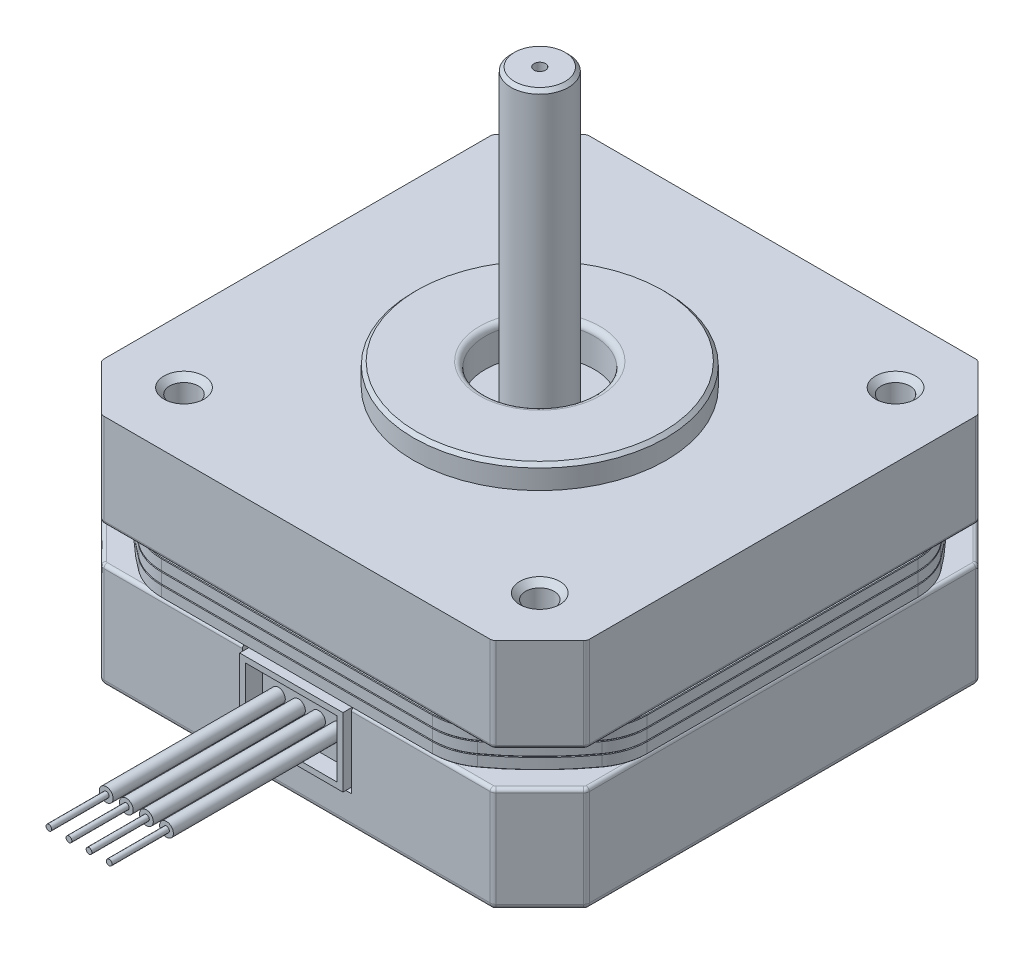
from build123d import *

# Parameters (mm, degrees)
EXTRUDE_1_DEPTH        = 9.2
EXTRUDE_START          = 20.4
EXTRUDE_2_DEPTH        = 8.2
EXTRUDE_3_DEPTH        = 1
PATTERN_LINEAR_1_COUNT = 3
PATTERN_LINEAR_1_PITCH = 1
SKETCH_3_R             = 4.75
CUT_EXTRUDE_1_DEPTH    = 3
SKETCH_4_R             = 4.75
SKETCH_4_R_2           = 2.5
CUT_EXTRUDE_2_DEPTH    = 0.5
SKETCH_5_R             = 0.5
CUT_EXTRUDE_3_DEPTH    = 0.5
CHAMFER_1_SIZE         = 0.3
FILLET_1_R             = 0.5
FILLET_2_R             = 0.5
SKETCH_6_R             = 11
SKETCH_6_R_2           = 4.75
EXTRUDE_4_DEPTH        = 2
CUT_EXTRUDE_START      = -1
SKETCH_7_R             = 4.75
CUT_EXTRUDE_4_DEPTH    = 1
CHAMFER_2_SIZE         = 0.3
FILLET_3_R             = 0.5
SKETCH_8_R             = 2.5
EXTRUDE_5_DEPTH        = 25.2
CHAMFER_4_SIZE         = 0.3
SKETCH_9_R             = 0.5
CUT_EXTRUDE_5_DEPTH    = 1
SKETCH_10_W            = 9.5
SKETCH_10_H            = 6.5
CUT_EXTRUDE_6_DEPTH    = 1
SKETCH_11_W            = 9
SKETCH_11_H            = 6
SKETCH_11_W_2          = 8
SKETCH_11_H_2          = 5
EXTRUDE_6_DEPTH        = 1.5
SKETCH_12_R            = 0.6
SKETCH_12_R_2          = 0.25
EXTRUDE_7_DEPTH        = 15
EXTRUDE_7_2_DEPTH      = 15
EXTRUDE_7_3_DEPTH      = 15
EXTRUDE_7_4_DEPTH      = 15
SKETCH_12_2_R          = 0.25
EXTRUDE_8_DEPTH        = 20
EXTRUDE_8_2_DEPTH      = 20
EXTRUDE_8_3_DEPTH      = 20
EXTRUDE_8_4_DEPTH      = 20
CHAMFER_32_SIZE        = 0.05
CHAMFER_33_SIZE        = 0.05
CHAMFER_34_SIZE        = 0.05
SKETCH_16_R            = 1.25
CUT_EXTRUDE_9_DEPTH    = 7
CHAMFER_35_SIZE        = 0.5
FILLET_4_R             = 0.3
FILLET_5_R             = 0.3


with BuildPart() as part:
    # Эскиз1 → Бобышка-Вытянуть1 (new body)
    with BuildSketch(Plane(origin=(0, 0, 0), x_dir=(1, 0, 0), z_dir=(0, 1, 0))):
        Polygon((-17.033766184, 21.15), (-21.15, 17.033766184), (-21.15, -17.033766184), (-17.033766184, -21.15), (17.033766184, -21.15), (21.15, -17.033766184), (21.15, 17.033766184), (17.033766184, 21.15), align=None)
    extrude(amount=EXTRUDE_1_DEPTH)

    # Эскиз3 → Вырез-Вытянуть1 (cut)
    with BuildSketch(Plane.XZ):
        with Locations(Location((0, 0, 0), (0, 0, 270))):
            Circle(SKETCH_3_R)
    extrude(amount=-CUT_EXTRUDE_1_DEPTH, mode=Mode.SUBTRACT)

    # Эскиз4 → Вырез-Вытянуть2 (cut)
    with BuildSketch(Plane.XZ.offset(-3)):
        with Locations(Location((0, 0, 0), (0, 0, 270))):
            Circle(SKETCH_4_R)
        with Locations(Location((0, 0, 0), (0, 0, 270))):
            Circle(SKETCH_4_R_2, mode=Mode.SUBTRACT)
    extrude(amount=-CUT_EXTRUDE_2_DEPTH, mode=Mode.SUBTRACT)

    # Эскиз5 → Вырез-Вытянуть3 (cut)
    with BuildSketch(Plane.XZ.offset(-3)):
        with Locations(Location((0, 0, 0), (0, 0, 270))):
            Circle(SKETCH_5_R)
    extrude(amount=-CUT_EXTRUDE_3_DEPTH, mode=Mode.SUBTRACT)

    # Фаска1
    chamfer_1_edges = [part.edges().sort_by_distance(p)[0] for p in [
        (0, 3, 2.5),
    ]]
    chamfer(chamfer_1_edges, length=CHAMFER_1_SIZE)

    # Скругление1
    fillet_1_edges = [part.edges().sort_by_distance(p)[0] for p in [
        (-21.15, 0, 0),
        (-19.091883092, 0, -19.091883092),
        (0, 0, -21.15),
        (19.091883092, 0, -19.091883092),
        (21.15, 0, 0),
        (19.091883092, 0, 19.091883092),
        (0, 0, 21.15),
        (-19.091883092, 0, 19.091883092),
        (-21.15, 4.6, 17.033766184),
        (-21.15, 4.6, -17.033766184),
        (-17.033766184, 4.6, -21.15),
        (17.033766184, 4.6, -21.15),
        (21.15, 4.6, -17.033766184),
        (21.15, 4.6, 17.033766184),
        (17.033766184, 4.6, 21.15),
        (-17.033766184, 4.6, 21.15),
        (0, 0, 4.75),
    ]]
    fillet(fillet_1_edges, radius=FILLET_1_R)

    # Эскиз10 → Вырез-Вытянуть6 (cut)
    with BuildSketch(Plane.XY.offset(21.15)):
        with Locations((0, 5.95)):
            Rectangle(SKETCH_10_W, SKETCH_10_H)
    extrude(amount=-CUT_EXTRUDE_6_DEPTH, mode=Mode.SUBTRACT)

    # Скругление4
    fillet_4_edges = [part.edges().sort_by_distance(p)[0] for p in [
        (10.788329701, 9.2, 21.15),
        (-10.788329701, 9.2, 21.15),
        (19.091883092, 9.2, 19.091883092),
        (21.15, 9.2, 0),
        (19.091883092, 9.2, -19.091883092),
        (0, 9.2, -21.15),
        (-19.091883092, 9.2, -19.091883092),
        (-21.15, 9.2, 0),
        (-19.091883092, 9.2, 19.091883092),
        (21.111939766, 9.2, -17.018001119),
        (17.018001119, 9.2, -21.111939766),
        (-17.018001119, 9.2, -21.111939766),
        (-21.111939766, 9.2, -17.018001119),
        (-21.111939766, 9.2, 17.018001119),
        (-17.018001119, 9.2, 21.111939766),
        (17.018001119, 9.2, 21.111939766),
        (21.111939766, 9.2, 17.018001119),
    ]]
    fillet(fillet_4_edges, radius=FILLET_4_R)


with BuildPart() as body_2:
    # Эскиз1<3> → Бобышка-Вытянуть2 (new body)
    with BuildSketch(Plane(origin=(0, 0, 0), x_dir=(1, 0, 0), z_dir=(0, 1, 0)).offset(EXTRUDE_START)):
        Polygon((-17.033766184, 21.15), (-21.15, 17.033766184), (-21.15, -17.033766184), (-17.033766184, -21.15), (17.033766184, -21.15), (21.15, -17.033766184), (21.15, 17.033766184), (17.033766184, 21.15), align=None)
    extrude(amount=-EXTRUDE_2_DEPTH)

    # Скругление2
    fillet_2_edges = [body_2.edges().sort_by_distance(p)[0] for p in [
        (-21.15, 16.3, 17.033766184),
        (-21.15, 16.3, -17.033766184),
        (-17.033766184, 16.3, -21.15),
        (17.033766184, 16.3, -21.15),
        (21.15, 16.3, -17.033766184),
        (21.15, 16.3, 17.033766184),
        (17.033766184, 16.3, 21.15),
        (-17.033766184, 16.3, 21.15),
    ]]
    fillet(fillet_2_edges, radius=FILLET_2_R)

    # Эскиз6 → Бобышка-Вытянуть4 (add)
    with BuildSketch(Plane(origin=(0, 20.4, 0), x_dir=(1, 0, 0), z_dir=(0, 1, 0))):
        with Locations(Location((0, 0, 0), (0, 0, 270))):
            Circle(SKETCH_6_R)
        with Locations(Location((0, 0, 0), (0, 0, 270))):
            Circle(SKETCH_6_R_2, mode=Mode.SUBTRACT)
    extrude(amount=EXTRUDE_4_DEPTH)

    # Эскиз7 → Вырез-Вытянуть4 (cut)
    with BuildSketch(Plane(origin=(0, 20.4, 0), x_dir=(1, 0, 0), z_dir=(0, 1, 0)).offset(CUT_EXTRUDE_START)):
        with Locations(Location((0, 0, 0), (0, 0, 270))):
            Circle(SKETCH_7_R)
    extrude(amount=CUT_EXTRUDE_4_DEPTH, mode=Mode.SUBTRACT)

    # Фаска2
    chamfer_2_edges = [body_2.edges().sort_by_distance(p)[0] for p in [
        (0, 22.4, -11),
    ]]
    chamfer(chamfer_2_edges, length=CHAMFER_2_SIZE)

    # Скругление3
    fillet_3_edges = [body_2.edges().sort_by_distance(p)[0] for p in [
        (0, 22.4, -4.75),
    ]]
    fillet(fillet_3_edges, radius=FILLET_3_R)

    # Эскиз8 → Бобышка-Вытянуть5 (add)
    with BuildSketch(Plane(origin=(0, 19.4, 0), x_dir=(1, 0, 0), z_dir=(0, 1, 0))):
        with Locations(Location((0, 0, 0), (0, 0, 270))):
            Circle(SKETCH_8_R)
    extrude(amount=EXTRUDE_5_DEPTH)

    # Фаска4
    chamfer_4_edges = [body_2.edges().sort_by_distance(p)[0] for p in [
        (0, 44.6, -2.5),
    ]]
    chamfer(chamfer_4_edges, length=CHAMFER_4_SIZE)

    # Эскиз9 → Вырез-Вытянуть5 (cut)
    with BuildSketch(Plane(origin=(0, 44.6, 0), x_dir=(1, 0, 0), z_dir=(0, 1, 0)).offset(CUT_EXTRUDE_START)):
        with Locations(Location((0, 0, 0), (0, 0, 270))):
            Circle(SKETCH_9_R)
    extrude(amount=CUT_EXTRUDE_5_DEPTH, mode=Mode.SUBTRACT)

    # Эскиз16 → Вырез-Вытянуть9 (cut)
    with BuildSketch(Plane(origin=(0, 20.4, 0), x_dir=(1, 0, 0), z_dir=(0, 1, 0))):
        with Locations(Location((-15.5, 15.5, 0), (0, 0, 270))):
            Circle(SKETCH_16_R)
        with Locations(Location((15.5, 15.5, 0), (0, 0, 270))):
            Circle(SKETCH_16_R)
        with Locations(Location((15.5, -15.5, 0), (0, 0, 270))):
            Circle(SKETCH_16_R)
        with Locations(Location((-15.5, -15.5, 0), (0, 0, 270))):
            Circle(SKETCH_16_R)
    extrude(amount=-CUT_EXTRUDE_9_DEPTH, mode=Mode.SUBTRACT)

    # Фаска35
    chamfer_35_edges = [body_2.edges().sort_by_distance(p)[0] for p in [
        (-15.5, 20.4, -16.75),
        (15.5, 20.4, -16.75),
        (15.5, 20.4, 14.25),
        (-15.5, 20.4, 14.25),
    ]]
    chamfer(chamfer_35_edges, length=CHAMFER_35_SIZE)

    # Скругление5
    fillet_5_edges = [body_2.edges().sort_by_distance(p)[0] for p in [
        (19.091883092, 12.2, 19.091883092),
        (21.15, 12.2, 0),
        (-19.091883092, 12.2, 19.091883092),
        (-21.15, 12.2, 0),
        (-19.091883092, 12.2, -19.091883092),
        (0, 12.2, -21.15),
        (19.091883092, 12.2, -19.091883092),
        (0, 12.2, 21.15),
        (21.111939766, 12.2, -17.018001119),
        (17.018001119, 12.2, -21.111939766),
        (-17.018001119, 12.2, -21.111939766),
        (-21.111939766, 12.2, -17.018001119),
        (-21.111939766, 12.2, 17.018001119),
        (-17.018001119, 12.2, 21.111939766),
        (17.018001119, 12.2, 21.111939766),
        (21.111939766, 12.2, 17.018001119),
    ]]
    fillet(fillet_5_edges, radius=FILLET_5_R)


with BuildPart() as body_3:
    # Эскиз2 → Бобышка-Вытянуть3 (new body)
    with BuildSketch(Plane(origin=(0, 9.2, 0), x_dir=(1, 0, 0), z_dir=(0, 1, 0))):
        with BuildLine():
            Line((-11.797351398, -21.15), (11.797351398, -21.15))
            ThreePointArc((11.797351398, -21.15), (13.348560603, -20.903288335), (14.746689247, -20.1875))
            ThreePointArc((14.746689247, -20.1875), (17.67766953, -17.67766953), (20.1875, -14.746689247))
            ThreePointArc((20.1875, -14.746689247), (20.903288335, -13.348560603), (21.15, -11.797351398))
            Line((21.15, -11.797351398), (21.15, 11.797351398))
            ThreePointArc((21.15, 11.797351398), (20.903288335, 13.348560603), (20.1875, 14.746689247))
            ThreePointArc((20.1875, 14.746689247), (17.67766953, 17.67766953), (14.746689247, 20.1875))
            ThreePointArc((14.746689247, 20.1875), (13.348560603, 20.903288335), (11.797351398, 21.15))
            Line((11.797351398, 21.15), (-11.797351398, 21.15))
            ThreePointArc((-11.797351398, 21.15), (-13.348560603, 20.903288335), (-14.746689247, 20.1875))
            ThreePointArc((-14.746689247, 20.1875), (-17.67766953, 17.67766953), (-20.1875, 14.746689247))
            ThreePointArc((-20.1875, 14.746689247), (-20.903288335, 13.348560603), (-21.15, 11.797351398))
            Line((-21.15, 11.797351398), (-21.15, -11.797351398))
            ThreePointArc((-21.15, -11.797351398), (-20.903288335, -13.348560603), (-20.1875, -14.746689247))
            ThreePointArc((-20.1875, -14.746689247), (-17.67766953, -17.67766953), (-14.746689247, -20.1875))
            ThreePointArc((-14.746689247, -20.1875), (-13.348560603, -20.903288335), (-11.797351398, -21.15))
        make_face()
    extrude(amount=EXTRUDE_3_DEPTH)


with BuildPart() as pattern_linear_1_1:
    # Линейный массив1: pattern copy
    add(body_3.part.moved(Location(Vector(0, 1, 0) * (1 * PATTERN_LINEAR_1_PITCH))))

    # Фаска33
    chamfer_33_edges = [pattern_linear_1_1.edges().sort_by_distance(p)[0] for p in [
        (-13.348560603, 11.2, -20.903288335),
        (-17.67766953, 11.2, -17.67766953),
        (17.67766953, 10.2, -17.67766953),
        (20.903288335, 10.2, -13.348560603),
        (21.15, 10.2, 0),
        (20.903288335, 10.2, 13.348560603),
        (17.67766953, 10.2, 17.67766953),
        (-20.903288335, 11.2, -13.348560603),
        (13.348560603, 10.2, 20.903288335),
        (0, 10.2, 21.15),
        (-13.348560603, 10.2, 20.903288335),
        (-17.67766953, 10.2, 17.67766953),
        (-20.903288335, 10.2, 13.348560603),
        (-21.15, 10.2, 0),
        (-20.903288335, 10.2, -13.348560603),
        (-17.67766953, 10.2, -17.67766953),
        (-21.15, 11.2, 0),
        (-13.348560603, 10.2, -20.903288335),
        (0, 10.2, -21.15),
        (13.348560603, 10.2, -20.903288335),
        (-20.903288335, 11.2, 13.348560603),
        (-17.67766953, 11.2, 17.67766953),
        (-13.348560603, 11.2, 20.903288335),
        (0, 11.2, 21.15),
        (13.348560603, 11.2, 20.903288335),
        (17.67766953, 11.2, 17.67766953),
        (13.348560603, 11.2, -20.903288335),
        (20.903288335, 11.2, 13.348560603),
        (21.15, 11.2, 0),
        (20.903288335, 11.2, -13.348560603),
        (17.67766953, 11.2, -17.67766953),
        (0, 11.2, -21.15),
    ]]
    chamfer(chamfer_33_edges, length=CHAMFER_33_SIZE)


with BuildPart() as pattern_linear_1_2:
    # Линейный массив1: pattern copy
    add(body_3.part.moved(Location(Vector(0, 1, 0) * (2 * PATTERN_LINEAR_1_PITCH))))

    # Фаска32
    chamfer_32_edges = [pattern_linear_1_2.edges().sort_by_distance(p)[0] for p in [
        (-13.348560603, 12.2, -20.903288335),
        (-17.67766953, 12.2, -17.67766953),
        (17.67766953, 11.2, -17.67766953),
        (20.903288335, 11.2, -13.348560603),
        (21.15, 11.2, 0),
        (20.903288335, 11.2, 13.348560603),
        (17.67766953, 11.2, 17.67766953),
        (-20.903288335, 12.2, -13.348560603),
        (13.348560603, 11.2, 20.903288335),
        (0, 11.2, 21.15),
        (-13.348560603, 11.2, 20.903288335),
        (-17.67766953, 11.2, 17.67766953),
        (-20.903288335, 11.2, 13.348560603),
        (-21.15, 11.2, 0),
        (-20.903288335, 11.2, -13.348560603),
        (-17.67766953, 11.2, -17.67766953),
        (-21.15, 12.2, 0),
        (-13.348560603, 11.2, -20.903288335),
        (0, 11.2, -21.15),
        (13.348560603, 11.2, -20.903288335),
        (-20.903288335, 12.2, 13.348560603),
        (-17.67766953, 12.2, 17.67766953),
        (-13.348560603, 12.2, 20.903288335),
        (0, 12.2, 21.15),
        (13.348560603, 12.2, 20.903288335),
        (17.67766953, 12.2, 17.67766953),
        (13.348560603, 12.2, -20.903288335),
        (20.903288335, 12.2, 13.348560603),
        (21.15, 12.2, 0),
        (20.903288335, 12.2, -13.348560603),
        (17.67766953, 12.2, -17.67766953),
        (0, 12.2, -21.15),
    ]]
    chamfer(chamfer_32_edges, length=CHAMFER_32_SIZE)


with BuildPart() as body_6:
    # Эскиз11 → Бобышка-Вытянуть6 (new body)
    with BuildSketch(Plane.XY.offset(20.15)):
        with Locations((0, 5.95)):
            Rectangle(SKETCH_11_W, SKETCH_11_H)
        with Locations((0, 5.95)):
            Rectangle(SKETCH_11_W_2, SKETCH_11_H_2, mode=Mode.SUBTRACT)
    extrude(amount=EXTRUDE_6_DEPTH)


with BuildPart() as body_7:
    # Эскиз12 → Бобышка-Вытянуть7 (new body)
    with BuildSketch(Plane.XY.offset(20.15)):
        with Locations((-2.625, 5.95)):
            Circle(SKETCH_12_R)
        with Locations((-2.625, 5.95)):
            Circle(SKETCH_12_R_2, mode=Mode.SUBTRACT)
    extrude(amount=EXTRUDE_7_DEPTH)


with BuildPart() as body_8:
    # Эскиз12 → Extrude 7 2 (new body)
    with BuildSketch(Plane.XY.offset(20.15)):
        with Locations((-0.875, 5.95)):
            Circle(SKETCH_12_R)
        with Locations((-0.875, 5.95)):
            Circle(SKETCH_12_R_2, mode=Mode.SUBTRACT)
    extrude(amount=EXTRUDE_7_2_DEPTH)


with BuildPart() as body_9:
    # Эскиз12 → Extrude 7 3 (new body)
    with BuildSketch(Plane.XY.offset(20.15)):
        with Locations((0.875, 5.95)):
            Circle(SKETCH_12_R)
        with Locations((0.875, 5.95)):
            Circle(SKETCH_12_R_2, mode=Mode.SUBTRACT)
    extrude(amount=EXTRUDE_7_3_DEPTH)


with BuildPart() as body_10:
    # Эскиз12 → Extrude 7 4 (new body)
    with BuildSketch(Plane.XY.offset(20.15)):
        with Locations((2.625, 5.95)):
            Circle(SKETCH_12_R)
        with Locations((2.625, 5.95)):
            Circle(SKETCH_12_R_2, mode=Mode.SUBTRACT)
    extrude(amount=EXTRUDE_7_4_DEPTH)


with BuildPart() as body_11:
    # Эскиз12<2> → Бобышка-Вытянуть8 (new body)
    with BuildSketch(Plane.XY.offset(20.15)):
        with Locations((-2.625, 5.95)):
            Circle(SKETCH_12_2_R)
    extrude(amount=EXTRUDE_8_DEPTH)


with BuildPart() as body_12:
    # Эскиз12<2> → Extrude 8 2 (new body)
    with BuildSketch(Plane.XY.offset(20.15)):
        with Locations((-0.875, 5.95)):
            Circle(SKETCH_12_2_R)
    extrude(amount=EXTRUDE_8_2_DEPTH)


with BuildPart() as body_13:
    # Эскиз12<2> → Extrude 8 3 (new body)
    with BuildSketch(Plane.XY.offset(20.15)):
        with Locations((0.875, 5.95)):
            Circle(SKETCH_12_2_R)
    extrude(amount=EXTRUDE_8_3_DEPTH)


with BuildPart() as body_14:
    # Эскиз12<2> → Extrude 8 4 (new body)
    with BuildSketch(Plane.XY.offset(20.15)):
        with Locations((2.625, 5.95)):
            Circle(SKETCH_12_2_R)
    extrude(amount=EXTRUDE_8_4_DEPTH)


with BuildPart() as body_3_1:
    add(body_3.part)

    # Фаска34
    chamfer_34_edges = [body_3_1.edges().sort_by_distance(p)[0] for p in [
        (-13.348560603, 10.2, -20.903288335),
        (-17.67766953, 10.2, -17.67766953),
        (17.67766953, 9.2, -17.67766953),
        (20.903288335, 9.2, -13.348560603),
        (21.15, 9.2, 0),
        (20.903288335, 9.2, 13.348560603),
        (17.67766953, 9.2, 17.67766953),
        (-20.903288335, 10.2, -13.348560603),
        (13.348560603, 9.2, 20.903288335),
        (0, 9.2, 21.15),
        (-13.348560603, 9.2, 20.903288335),
        (-17.67766953, 9.2, 17.67766953),
        (-20.903288335, 9.2, 13.348560603),
        (-21.15, 9.2, 0),
        (-20.903288335, 9.2, -13.348560603),
        (-17.67766953, 9.2, -17.67766953),
        (-21.15, 10.2, 0),
        (-13.348560603, 9.2, -20.903288335),
        (0, 9.2, -21.15),
        (13.348560603, 9.2, -20.903288335),
        (-20.903288335, 10.2, 13.348560603),
        (-17.67766953, 10.2, 17.67766953),
        (-13.348560603, 10.2, 20.903288335),
        (0, 10.2, 21.15),
        (13.348560603, 10.2, 20.903288335),
        (17.67766953, 10.2, 17.67766953),
        (13.348560603, 10.2, -20.903288335),
        (20.903288335, 10.2, 13.348560603),
        (21.15, 10.2, 0),
        (20.903288335, 10.2, -13.348560603),
        (17.67766953, 10.2, -17.67766953),
        (0, 10.2, -21.15),
    ]]
    chamfer(chamfer_34_edges, length=CHAMFER_34_SIZE)


solid = Compound([part.part, body_2.part, pattern_linear_1_1.part, pattern_linear_1_2.part, body_6.part, body_7.part, body_8.part, body_9.part, body_10.part, body_11.part, body_12.part, body_13.part, body_14.part, body_3_1.part])
